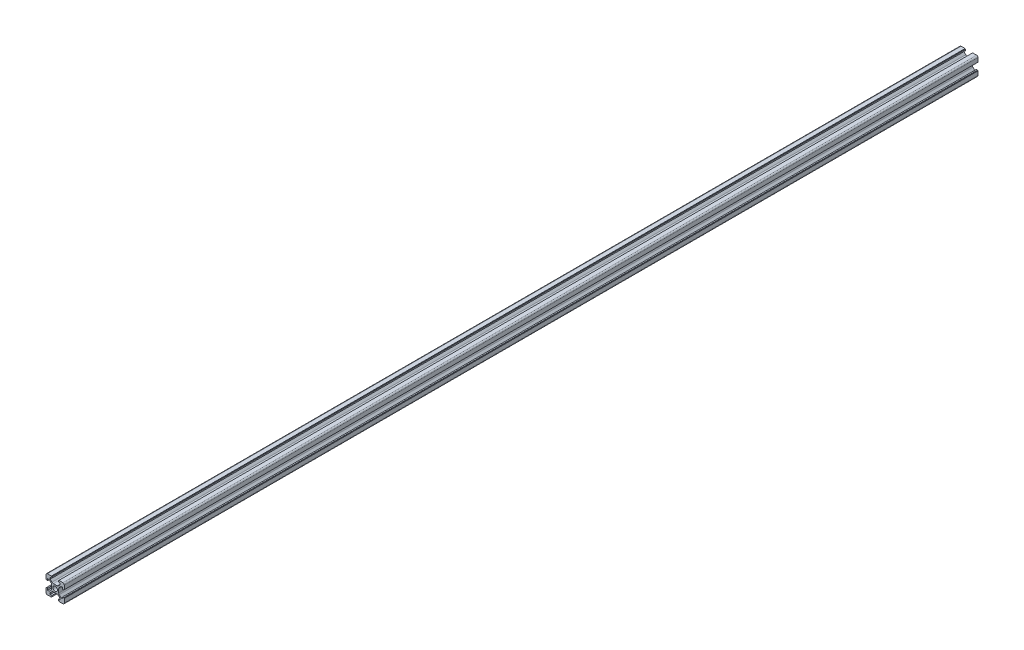
from build123d import *

# Parameters (mm, degrees)
SKETCH1_R           = 2.5
BOSS_EXTRUDE2_DEPTH = 1000


with BuildPart() as part:
    # Sketch1 → Boss-Extrude2 (new body)
    with BuildSketch(Plane.XY):
        with BuildLine():
            Line((10, -4.1), (10, -8.5))
            ThreePointArc((10, -8.5), (9.560660172, -9.560660172), (8.5, -10))
            Line((8.5, -10), (4.1, -10))
            Line((4.1, -10), (4.1, -9.5))
            Line((4.1, -9.5), (3.6, -9.5))
            Line((3.6, -9.5), (3.6, -8.2))
            Line((3.6, -8.2), (5.5, -8.2))
            Line((5.5, -8.2), (5.5, -6.560660172))
            Line((5.5, -6.560660172), (3.425126266, -4.485786438))
            ThreePointArc((3.425126266, -4.485786438), (2.776279568, -4.052240935), (2.010912703, -3.9))
            Line((2.010912703, -3.9), (-2.010912703, -3.9))
            ThreePointArc((-2.010912703, -3.9), (-2.776279568, -4.052240935), (-3.425126266, -4.485786438))
            Line((-3.425126266, -4.485786438), (-5.5, -6.560660172))
            Line((-5.5, -6.560660172), (-5.5, -8.2))
            Line((-5.5, -8.2), (-3.6, -8.2))
            Line((-3.6, -8.2), (-3.6, -9.5))
            Line((-3.6, -9.5), (-4.1, -9.5))
            Line((-4.1, -9.5), (-4.1, -10))
            Line((-4.1, -10), (-8.5, -10))
            ThreePointArc((-8.5, -10), (-9.560660172, -9.560660172), (-10, -8.5))
            Line((-10, -8.5), (-10, -4.1))
            Line((-10, -4.1), (-9.5, -4.1))
            Line((-9.5, -4.1), (-9.5, -3.6))
            Line((-9.5, -3.6), (-8.2, -3.6))
            Line((-8.2, -3.6), (-8.2, -5.5))
            Line((-8.2, -5.5), (-6.560660172, -5.5))
            Line((-6.560660172, -5.5), (-4.485786438, -3.425126266))
            ThreePointArc((-4.485786438, -3.425126266), (-4.052240935, -2.776279568), (-3.9, -2.010912703))
            Line((-3.9, -2.010912703), (-3.9, 2.010912703))
            ThreePointArc((-3.9, 2.010912703), (-4.052240935, 2.776279568), (-4.485786438, 3.425126266))
            Line((-4.485786438, 3.425126266), (-6.560660172, 5.5))
            Line((-6.560660172, 5.5), (-8.2, 5.5))
            Line((-8.2, 5.5), (-8.2, 3.6))
            Line((-8.2, 3.6), (-9.5, 3.6))
            Line((-9.5, 3.6), (-9.5, 4.1))
            Line((-9.5, 4.1), (-10, 4.1))
            Line((-10, 4.1), (-10, 8.5))
            ThreePointArc((-10, 8.5), (-9.560660172, 9.560660172), (-8.5, 10))
            Line((-8.5, 10), (-4.1, 10))
            Line((-4.1, 10), (-4.1, 9.5))
            Line((-4.1, 9.5), (-3.6, 9.5))
            Line((-3.6, 9.5), (-3.6, 8.2))
            Line((-3.6, 8.2), (-5.5, 8.2))
            Line((-5.5, 8.2), (-5.5, 6.560660172))
            Line((-5.5, 6.560660172), (-3.425126266, 4.485786438))
            ThreePointArc((-3.425126266, 4.485786438), (-2.776279568, 4.052240935), (-2.010912703, 3.9))
            Line((-2.010912703, 3.9), (2.010912703, 3.9))
            ThreePointArc((2.010912703, 3.9), (2.776279568, 4.052240935), (3.425126266, 4.485786438))
            Line((3.425126266, 4.485786438), (5.5, 6.560660172))
            Line((5.5, 6.560660172), (5.5, 8.2))
            Line((5.5, 8.2), (3.6, 8.2))
            Line((3.6, 8.2), (3.6, 9.5))
            Line((3.6, 9.5), (4.1, 9.5))
            Line((4.1, 9.5), (4.1, 10))
            Line((4.1, 10), (8.5, 10))
            ThreePointArc((8.5, 10), (9.560660172, 9.560660172), (10, 8.5))
            Line((10, 8.5), (10, 4.1))
            Line((10, 4.1), (9.5, 4.1))
            Line((9.5, 4.1), (9.5, 3.6))
            Line((9.5, 3.6), (8.2, 3.6))
            Line((8.2, 3.6), (8.2, 5.5))
            Line((8.2, 5.5), (6.560660172, 5.5))
            Line((6.560660172, 5.5), (4.485786438, 3.425126266))
            ThreePointArc((4.485786438, 3.425126266), (4.052240935, 2.776279568), (3.9, 2.010912703))
            Line((3.9, 2.010912703), (3.9, -2.010912703))
            ThreePointArc((3.9, -2.010912703), (4.052240935, -2.776279568), (4.485786438, -3.425126266))
            Line((4.485786438, -3.425126266), (6.560660172, -5.5))
            Line((6.560660172, -5.5), (8.2, -5.5))
            Line((8.2, -5.5), (8.2, -3.6))
            Line((8.2, -3.6), (9.5, -3.6))
            Line((9.5, -3.6), (9.5, -4.1))
            Line((9.5, -4.1), (10, -4.1))
        make_face()
        Circle(SKETCH1_R, mode=Mode.SUBTRACT)
    extrude(amount=BOSS_EXTRUDE2_DEPTH)


solid = part.part
